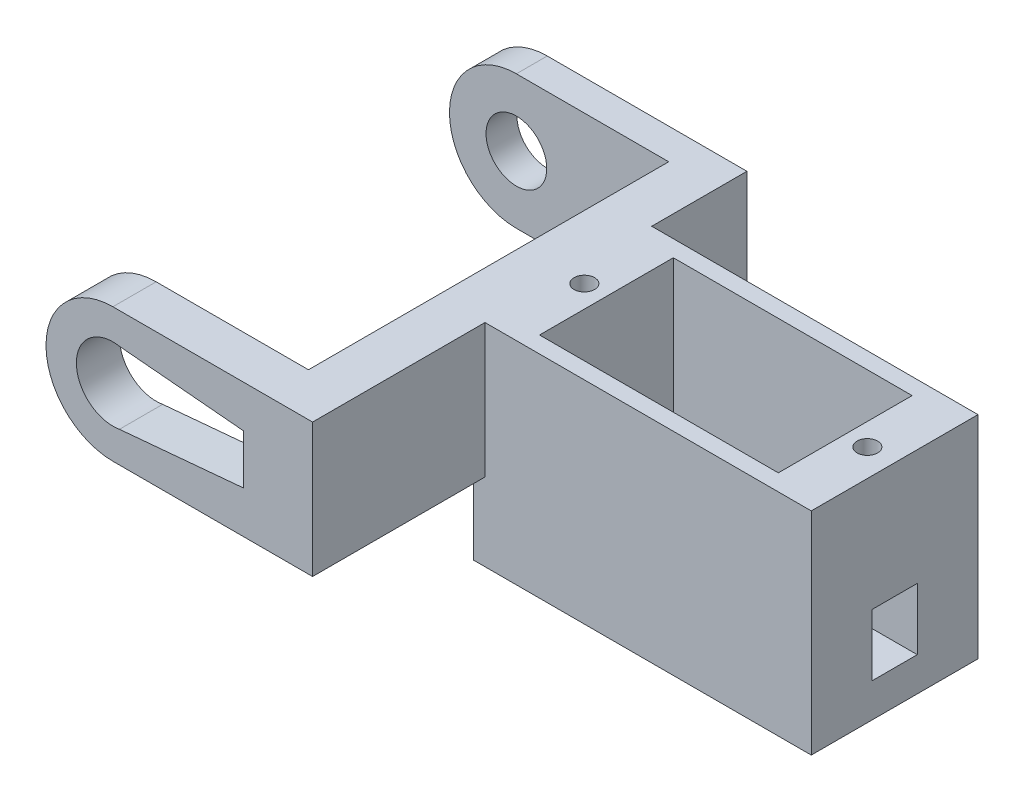
from build123d import *

# Parameters (mm, degrees)
BOSS_EXTRUDE1_START = 60.725
SKETCH1_W           = 32.8
SKETCH1_H           = 16.2
BOSS_EXTRUDE1_DEPTH = 10.275
BOSS_EXTRUDE2_START = -42.3
SKETCH2_W           = 42.2
SKETCH2_H           = 13
BOSS_EXTRUDE2_DEPTH = 2.3
BOSS_EXTRUDE3_START = 22.75
SKETCH3_R           = 6.5
BOSS_EXTRUDE3_DEPTH = 2.1
BOSS_EXTRUDE4_START = 22.75
SKETCH4_W           = 18.3
SKETCH4_H           = 13
BOSS_EXTRUDE4_DEPTH = 2.1
CUT_EXTRUDE1_START  = 22.75
SKETCH5_R           = 3.55
CUT_EXTRUDE1_DEPTH  = 2.1
CUT_EXTRUDE2_START  = 22.75
CUT_EXTRUDE2_DEPTH  = 2.1
BOSS_EXTRUDE5_START = -15.85
SKETCH7_R           = 6.5
BOSS_EXTRUDE5_DEPTH = 1.5
BOSS_EXTRUDE6_START = -15.85
SKETCH8_W           = 18.3
SKETCH8_H           = 13
BOSS_EXTRUDE6_DEPTH = 1.5
CUT_EXTRUDE3_START  = -15.85
SKETCH9_R           = 2.95
CUT_EXTRUDE3_DEPTH  = 1.5
CUT_EXTRUDE4_START  = 62.375
SKETCH10_W          = 23.2
SKETCH10_H          = 13
CUT_EXTRUDE4_DEPTH  = 8.625
CUT_EXTRUDE5_START  = 68
SKETCH11_R          = 1
CUT_EXTRUDE5_DEPTH  = 3
CUT_EXTRUDE6_START  = 68
SKETCH12_R          = 1
CUT_EXTRUDE6_DEPTH  = 3
CUT_EXTRUDE7_START  = 51.75
SKETCH13_R          = 3.15
CUT_EXTRUDE7_DEPTH  = 1.3
CUT_EXTRUDE8_START  = -10.7
SKETCH14_W          = 4.4
SKETCH14_H          = 6
CUT_EXTRUDE8_DEPTH  = 2.4


with BuildPart() as part:
    # Sketch1 → Boss-Extrude1 (new, symmetric)
    with BuildSketch(Plane(origin=(0, 0, 0), x_dir=(1, 0, 0), z_dir=(0, 1, 0)).offset(BOSS_EXTRUDE1_START)):
        with Locations((-24.7, 0)):
            Rectangle(SKETCH1_W, SKETCH1_H)
    extrude(amount=BOSS_EXTRUDE1_DEPTH, both=True)

    # Sketch2 → Boss-Extrude2 (add, symmetric)
    with BuildSketch(Plane(origin=(0, 0, 0), x_dir=(0, 0, -1), z_dir=(1, 0, 0)).offset(BOSS_EXTRUDE2_START)):
        with Locations((-3.75, 64.5)):
            Rectangle(SKETCH2_W, SKETCH2_H)
    extrude(amount=BOSS_EXTRUDE2_DEPTH, both=True)



with BuildPart() as body_2:
    # Sketch3 → Boss-Extrude3 (new, symmetric)
    with BuildSketch(Plane.XY.offset(BOSS_EXTRUDE3_START)):
        with Locations((-59.4, 64.5)):
            Circle(SKETCH3_R)
    extrude(amount=BOSS_EXTRUDE3_DEPTH, both=True)


with BuildPart() as part_1:
    add(part.part)

    add(body_2.part)  # Boss-Extrude4 merges body 2
    # Sketch4 → Boss-Extrude4 (add, symmetric)
    with BuildSketch(Plane.XY.offset(BOSS_EXTRUDE4_START)):
        with Locations((-50.25, 64.5)):
            Rectangle(SKETCH4_W, SKETCH4_H)
    extrude(amount=BOSS_EXTRUDE4_DEPTH, both=True)

    # Sketch5 → Cut-Extrude1 (cut, symmetric)
    with BuildSketch(Plane.XY.offset(CUT_EXTRUDE1_START)):
        with Locations((-59.4, 64.5)):
            Circle(SKETCH5_R)
    extrude(amount=CUT_EXTRUDE1_DEPTH, both=True, mode=Mode.SUBTRACT)

    # Sketch6 → Cut-Extrude2 (cut, symmetric)
    with BuildSketch(Plane.XY.offset(CUT_EXTRUDE2_START)):
        Polygon((-59.4, 60.95), (-46.7, 62.096718595), (-46.7, 66.903281405), (-59.4, 68.05), align=None)
    extrude(amount=CUT_EXTRUDE2_DEPTH, both=True, mode=Mode.SUBTRACT)



with BuildPart() as body_2_2:
    # Sketch7 → Boss-Extrude5 (new, symmetric)
    with BuildSketch(Plane.XY.offset(BOSS_EXTRUDE5_START)):
        with Locations((-59.4, 64.5)):
            Circle(SKETCH7_R)
    extrude(amount=BOSS_EXTRUDE5_DEPTH, both=True)


with BuildPart() as part_2:
    add(part_1.part)

    add(body_2_2.part)  # Boss-Extrude6 merges body 2 2
    # Sketch8 → Boss-Extrude6 (add, symmetric)
    with BuildSketch(Plane.XY.offset(BOSS_EXTRUDE6_START)):
        with Locations((-50.25, 64.5)):
            Rectangle(SKETCH8_W, SKETCH8_H)
    extrude(amount=BOSS_EXTRUDE6_DEPTH, both=True)

    # Sketch9 → Cut-Extrude3 (cut, symmetric)
    with BuildSketch(Plane.XY.offset(CUT_EXTRUDE3_START)):
        with Locations((-59.4, 64.5)):
            Circle(SKETCH9_R)
    extrude(amount=CUT_EXTRUDE3_DEPTH, both=True, mode=Mode.SUBTRACT)

    # Sketch10 → Cut-Extrude4 (cut, symmetric)
    with BuildSketch(Plane(origin=(0, 0, 0), x_dir=(1, 0, 0), z_dir=(0, 1, 0)).offset(CUT_EXTRUDE4_START)):
        with Locations((-24.7, 0)):
            Rectangle(SKETCH10_W, SKETCH10_H)
    extrude(amount=CUT_EXTRUDE4_DEPTH, both=True, mode=Mode.SUBTRACT)

    # Sketch11 → Cut-Extrude5 (cut, symmetric)
    with BuildSketch(Plane(origin=(0, 0, 0), x_dir=(1, 0, 0), z_dir=(0, 1, 0)).offset(CUT_EXTRUDE5_START)):
        with Locations(Location((-38.45, 0, 0), (0, 0, 270))):
            Circle(SKETCH11_R)
    extrude(amount=CUT_EXTRUDE5_DEPTH, both=True, mode=Mode.SUBTRACT)

    # Sketch12 → Cut-Extrude6 (cut, symmetric)
    with BuildSketch(Plane(origin=(0, 0, 0), x_dir=(1, 0, 0), z_dir=(0, 1, 0)).offset(CUT_EXTRUDE6_START)):
        with Locations(Location((-10.95, 0, 0), (0, 0, 270))):
            Circle(SKETCH12_R)
    extrude(amount=CUT_EXTRUDE6_DEPTH, both=True, mode=Mode.SUBTRACT)

    # Sketch13 → Cut-Extrude7 (cut, symmetric)
    with BuildSketch(Plane(origin=(0, 0, 0), x_dir=(1, 0, 0), z_dir=(0, 1, 0)).offset(CUT_EXTRUDE7_START)):
        with Locations(Location((-19.2, 0, 0), (0, 0, 270))):
            Circle(SKETCH13_R)
    extrude(amount=CUT_EXTRUDE7_DEPTH, both=True, mode=Mode.SUBTRACT)

    # Sketch14 → Cut-Extrude8 (cut, symmetric)
    with BuildSketch(Plane(origin=(0, 0, 0), x_dir=(0, 0, -1), z_dir=(1, 0, 0)).offset(CUT_EXTRUDE8_START)):
        with Locations((0, 56.75)):
            Rectangle(SKETCH14_W, SKETCH14_H)
    extrude(amount=CUT_EXTRUDE8_DEPTH, both=True, mode=Mode.SUBTRACT)


solid = part_2.part
